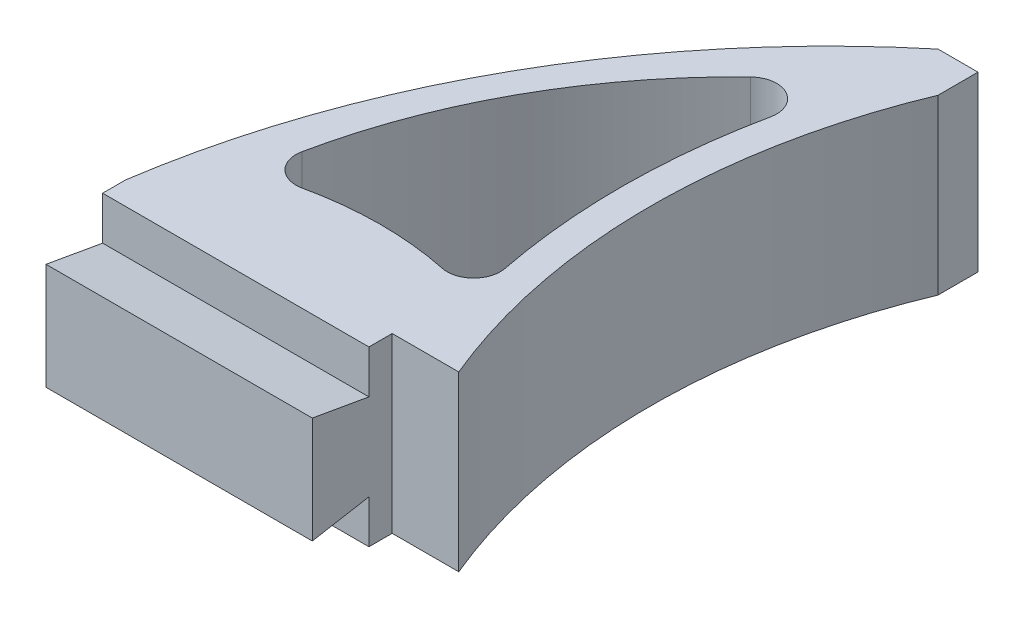
from build123d import *

# Parameters (mm, degrees)
EXTRUDE_1_DEPTH     = 6.5
CUT_EXTRUDE_1_DEPTH = 52.886896226
CUT_EXTRUDE_2_DEPTH = 54.09425581


with BuildPart() as part:
    # 草图1 → 凸台-拉伸1 (new, symmetric)
    with BuildSketch(Plane(origin=(0, 0, 0), x_dir=(1, 0, 0), z_dir=(0, 1, 0))):
        with BuildLine():
            Line((0, 0), (0, 6))
            ThreePointArc((0, 6), (7.402826909, 27.529174564), (22, 45))
            Line((22, 45), (25, 45))
            Line((25, 45), (25, 42))
            ThreePointArc((25, 42), (21.416586692, 24), (25, 6))
            Line((25, 6), (20, 6))
            Line((20, 6), (20, 0))
            Line((20, 0), (0, 0))
        make_face()
    extrude(amount=EXTRUDE_1_DEPTH, both=True)

    # 草图3 → 切除-拉伸1 (cut, through all)
    with BuildSketch(Plane.ZY):
        Polygon((0, 4), (0, 6.5), (-4.253461365, 6.5), (-4.253461365, 3.25), align=None)
        Polygon((0, -4), (-4.253461365, -3.25), (-4.253461365, -6.5), (0, -6.5), align=None)
    extrude(amount=-CUT_EXTRUDE_1_DEPTH, mode=Mode.SUBTRACT)

    # 草图4 → 切除-拉伸2 (cut, through all)
    with BuildSketch(Plane(origin=(0, 6.5, 0), x_dir=(1, 0, 0), z_dir=(0, 1, 0))):
        with BuildLine():
            ThreePointArc((7.169736852, 12.07909507), (12.400276965, 12.65373917), (17.63523501, 12.120841452))
            ThreePointArc((17.63523501, 12.120841452), (19.45114939, 12.654920589), (20.008524733, 14.463820333))
            ThreePointArc((20.008524733, 14.463820333), (19.071107342, 24.389014044), (20.121422197, 34.302896243))
            ThreePointArc((20.121422197, 34.302896243), (19.130864623, 36.4613018), (16.77629627, 36.151581393))
            ThreePointArc((16.77629627, 36.151581393), (9.141463638, 26.201122888), (4.785137328, 14.439970103))
            ThreePointArc((4.785137328, 14.439970103), (5.336190032, 12.611841621), (7.169736852, 12.07909507))
        make_face()
    extrude(amount=-CUT_EXTRUDE_2_DEPTH, mode=Mode.SUBTRACT)


solid = part.part
